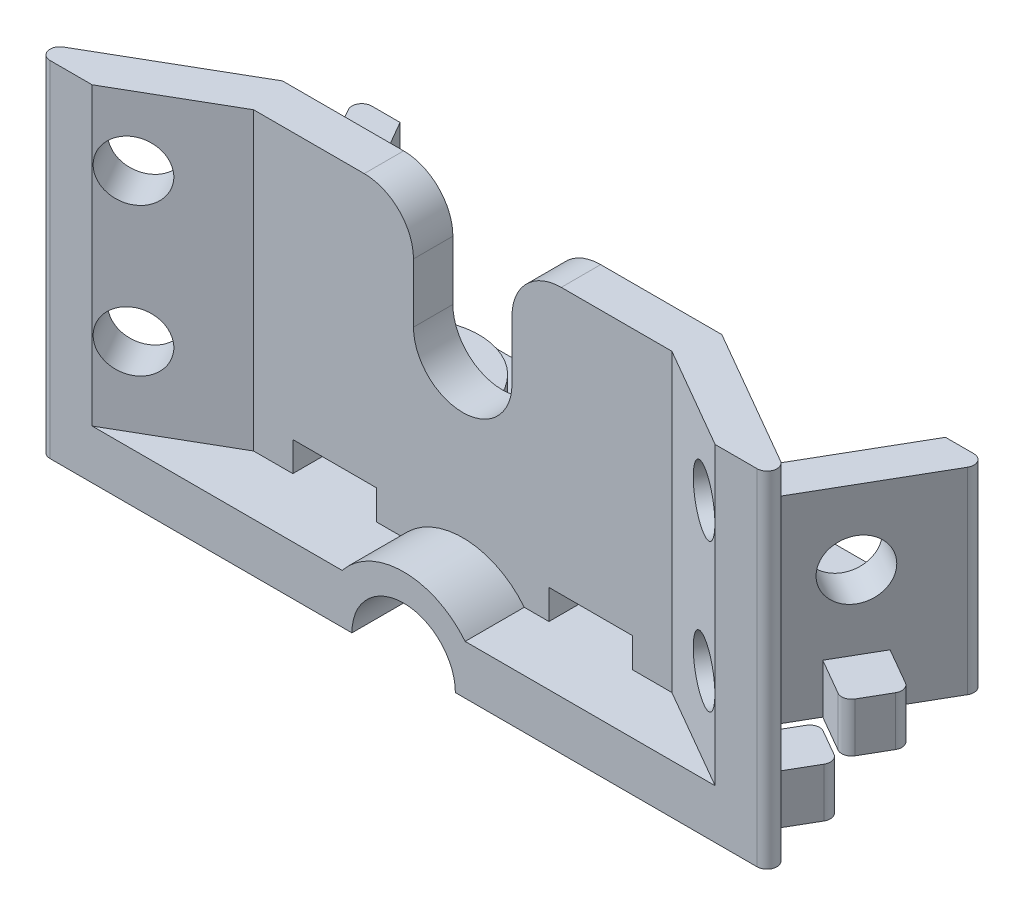
from build123d import *

# Parameters (mm, degrees)
BOSS_EXTRUDE1_DEPTH = 5
BOSS_EXTRUDE2_DEPTH = 30
BOSS_EXTRUDE3_DEPTH = 15
BOSS_EXTRUDE4_START = -27.320508
BOSS_EXTRUDE4_DEPTH = 27.320508
SKETCH6_R           = 5.25
CUT_EXTRUDE1_DEPTH  = 58.724937775
CUT_EXTRUDE2_DEPTH  = 56.139118094
SKETCH8_R           = 3
CUT_EXTRUDE3_DEPTH  = 61.901347721
SKETCH9_R           = 3
CUT_EXTRUDE4_DEPTH  = 70.587993831
SKETCH10_R          = 7
BOSS_EXTRUDE5_DEPTH = 7
SKETCH11_R          = 3
CUT_EXTRUDE5_DEPTH  = 52.343631003
CUT_EXTRUDE6_DEPTH  = 3
SKETCH14_R          = 1.5
CUT_EXTRUDE7_DEPTH  = 56.139118118


with BuildPart() as part:
    # Sketch2 → Boss-Extrude1 (new body)
    with BuildSketch(Plane(origin=(0, 0, 0), x_dir=(1, 0, 0), z_dir=(0, 1, 0))):
        with BuildLine():
            Line((-30.567949192, 27.320508076), (30.567949192, 27.320508076))
            ThreePointArc((30.567949192, 27.320508076), (31.433974596, 26.820508076), (31.433974596, 25.820508076))
            Line((31.433974596, 25.820508076), (28.55, 20.825317547))
            Line((28.55, 20.825317547), (32.230607966, 18.700317547))
            ThreePointArc((32.230607966, 18.700317547), (32.696533792, 18.093111189), (32.59663337, 17.334292144))
            Line((32.59663337, 17.334292144), (31.09663337, 14.736215932))
            ThreePointArc((31.09663337, 14.736215932), (30.489427011, 14.270290106), (29.730607966, 14.370190528))
            Line((29.730607966, 14.370190528), (26.05, 16.495190528))
            Line((26.05, 16.495190528), (22.3, 10))
            Line((22.3, 10), (28.795190528, 6.25))
            Line((28.795190528, 6.25), (30.920190528, 9.930607966))
            ThreePointArc((30.920190528, 9.930607966), (31.527396887, 10.396533792), (32.286215932, 10.29663337))
            Line((32.286215932, 10.29663337), (34.884292144, 8.79663337))
            ThreePointArc((34.884292144, 8.79663337), (35.35021797, 8.189427011), (35.250317547, 7.430607966))
            Line((35.250317547, 7.430607966), (33.125317547, 3.75))
            Line((33.125317547, 3.75), (36.388457268, 1.866025404))
            ThreePointArc((36.388457268, 1.866025404), (36.854383094, 0.741180955), (35.888457268, 0))
            Line((35.888457268, 0), (-35.888457268, 0))
            ThreePointArc((-35.888457268, 0), (-36.854383094, 0.741180955), (-36.388457268, 1.866025404))
            Line((-36.388457268, 1.866025404), (-33.125317547, 3.75))
            Line((-33.125317547, 3.75), (-35.250317547, 7.430607966))
            ThreePointArc((-35.250317547, 7.430607966), (-35.35021797, 8.189427011), (-34.884292144, 8.79663337))
            Line((-34.884292144, 8.79663337), (-32.286215932, 10.29663337))
            ThreePointArc((-32.286215932, 10.29663337), (-31.527396887, 10.396533792), (-30.920190528, 9.930607966))
            Line((-30.920190528, 9.930607966), (-28.795190528, 6.25))
            Line((-28.795190528, 6.25), (-22.3, 10))
            Line((-22.3, 10), (-26.05, 16.495190528))
            Line((-26.05, 16.495190528), (-29.730607966, 14.370190528))
            ThreePointArc((-29.730607966, 14.370190528), (-30.489427011, 14.270290106), (-31.09663337, 14.736215932))
            Line((-31.09663337, 14.736215932), (-32.59663337, 17.334292144))
            ThreePointArc((-32.59663337, 17.334292144), (-32.696533792, 18.093111189), (-32.230607966, 18.700317547))
            Line((-32.230607966, 18.700317547), (-28.55, 20.825317547))
            Line((-28.55, 20.825317547), (-31.433974596, 25.820508076))
            ThreePointArc((-31.433974596, 25.820508076), (-31.433974596, 26.820508076), (-30.567949192, 27.320508076))
        make_face()
    extrude(amount=BOSS_EXTRUDE1_DEPTH)

    # Sketch3 → Boss-Extrude2 (add)
    with BuildSketch(Plane(origin=(0, 5, 0), x_dir=(1, 0, 0), z_dir=(0, 1, 0))):
        with BuildLine():
            Line((-36.388457268, 1.866025404), (-22.3, 10))
            Line((-22.3, 10), (22.3, 10))
            Line((22.3, 10), (36.388457268, 1.866025404))
            ThreePointArc((36.388457268, 1.866025404), (36.854383094, 0.741180955), (35.888457268, 0))
            Line((35.888457268, 0), (31.620508076, 0))
            Line((31.620508076, 0), (21.22820323, 6))
            Line((21.22820323, 6), (-21.22820323, 6))
            Line((-21.22820323, 6), (-31.620508076, 0))
            Line((-31.620508076, 0), (-35.888457268, 0))
            ThreePointArc((-35.888457268, 0), (-36.854383094, 0.741180955), (-36.388457268, 1.866025404))
        make_face()
    extrude(amount=BOSS_EXTRUDE2_DEPTH)

    # Sketch4 → Boss-Extrude3 (add)
    with BuildSketch(Plane(origin=(0, 5, 0), x_dir=(1, 0, 0), z_dir=(0, 1, 0))):
        with BuildLine():
            Line((22.3, 10), (31.433974596, 25.820508076))
            ThreePointArc((31.433974596, 25.820508076), (31.433974596, 26.820508076), (30.567949192, 27.320508076))
            Line((30.567949192, 27.320508076), (27.681197846, 27.320508076))
            Line((27.681197846, 27.320508076), (17.681197846, 10))
            Line((17.681197846, 10), (22.3, 10))
        make_face()
        with BuildLine():
            Line((-27.681197846, 27.320508076), (-30.567949192, 27.320508076))
            ThreePointArc((-30.567949192, 27.320508076), (-31.433974596, 26.820508076), (-31.433974596, 25.820508076))
            Line((-31.433974596, 25.820508076), (-22.3, 10))
            Line((-22.3, 10), (-17.681197846, 10))
            Line((-17.681197846, 10), (-27.681197846, 27.320508076))
        make_face()
    extrude(amount=BOSS_EXTRUDE3_DEPTH)

    # Sketch5 → Boss-Extrude4 (add)
    with BuildSketch(Plane.XY.offset(BOSS_EXTRUDE4_START)):
        with BuildLine():
            Line((-8, 0), (8, 0))
            ThreePointArc((8, 0), (0, 8), (-8, 0))
        make_face()
    extrude(amount=BOSS_EXTRUDE4_DEPTH)

    # Sketch6 → Cut-Extrude1 (cut, through all)
    with BuildSketch(Plane.XY):
        Circle(SKETCH6_R)
    extrude(amount=-CUT_EXTRUDE1_DEPTH, mode=Mode.SUBTRACT)

    # Sketch7 → Cut-Extrude2 (cut, through all)
    with BuildSketch(Plane.XY.offset(-6)):
        with BuildLine():
            Line((-10, 35), (10, 35))
            ThreePointArc((10, 35), (6.464466094, 33.535533906), (5, 30))
            Line((5, 30), (5, 24))
            ThreePointArc((5, 24), (0, 19), (-5, 24))
            Line((-5, 24), (-5, 30))
            ThreePointArc((-5, 30), (-6.464466094, 33.535533906), (-10, 35))
        make_face()
    extrude(amount=-CUT_EXTRUDE2_DEPTH, mode=Mode.SUBTRACT)

    # Sketch8 → Cut-Extrude3 (cut, through all)
    with BuildSketch(Plane(origin=(-9.905127019, 0, -17.156183252), x_dir=(-0.8660254037844285, 0, 0.5000000000000177), z_dir=(-0.5000000000000177, 0, -0.8660254037844285))):
        with Locations((24.312366504, 28)):
            Circle(SKETCH8_R)
        with Locations((24.312366504, 13)):
            Circle(SKETCH8_R)
    cut_extrude3 = extrude(amount=-CUT_EXTRUDE3_DEPTH, mode=Mode.SUBTRACT)

    # Sketch9 → Cut-Extrude4 (cut, through all)
    with BuildSketch(Plane(origin=(-12.394872981, 0, 7.156183252), x_dir=(0.5000000000000591, 0, 0.8660254037844046), z_dir=(-0.8660254037844046, 0, 0.5000000000000591))):
        with Locations((-29.810254038, 12.5)):
            Circle(SKETCH9_R)
    cut_extrude4 = extrude(amount=-CUT_EXTRUDE4_DEPTH, mode=Mode.SUBTRACT)

    # Sketch10 → Boss-Extrude5 (add)
    with BuildSketch(Plane(origin=(0, 5, 0), x_dir=(1, 0, 0), z_dir=(0, 1, 0))):
        with Locations((-13, 13.660254038)):
            Circle(SKETCH10_R)
    boss_extrude5 = extrude(amount=BOSS_EXTRUDE5_DEPTH)

    # Sketch11 → Cut-Extrude5 (cut, through all)
    with BuildSketch(Plane(origin=(0, 12, 0), x_dir=(1, 0, 0), z_dir=(0, 1, 0))):
        with Locations(Location((-13, 13.660254038, 0), (0, 0, 270))):
            Circle(SKETCH11_R)
    cut_extrude5 = extrude(amount=-CUT_EXTRUDE5_DEPTH, mode=Mode.SUBTRACT)

    # Sketch13 → Cut-Extrude6 (cut)
    with BuildSketch(Plane(origin=(0, 5, 0), x_dir=(1, 0, 0), z_dir=(0, 1, 0))):
        Polygon((-17.25, 11.206515394), (-17.25, 6), (-8.75, 6), (-8.75, 11.206515394), (-8.75, 16.113992682), (-13, 18.567731326), (-17.25, 16.113992682), align=None)
    cut_extrude6 = extrude(amount=CUT_EXTRUDE6_DEPTH, mode=Mode.SUBTRACT)

    # Sketch14 → Cut-Extrude7 (cut, through all)
    with BuildSketch(Plane.XY.offset(-6)):
        with Locations(Location((-13, 6.5, 0), (0, 0, 270))):
            Circle(SKETCH14_R)
    cut_extrude7 = extrude(amount=-CUT_EXTRUDE7_DEPTH, mode=Mode.SUBTRACT)

    # Mirror1: Cut-Extrude3, Cut-Extrude4, Boss-Extrude5, Cut-Extrude5, Cut-Extrude6, Cut-Extrude7 across plane
    add(cut_extrude3.mirror(Plane(origin=(0, 0, 0), x_dir=(0, 0, 1), z_dir=(1, 0, 0))), mode=Mode.SUBTRACT)
    add(cut_extrude4.mirror(Plane(origin=(0, 0, 0), x_dir=(0, 0, 1), z_dir=(1, 0, 0))), mode=Mode.SUBTRACT)
    add(boss_extrude5.mirror(Plane(origin=(0, 0, 0), x_dir=(0, 0, 1), z_dir=(1, 0, 0))))
    add(cut_extrude5.mirror(Plane(origin=(0, 0, 0), x_dir=(0, 0, 1), z_dir=(1, 0, 0))), mode=Mode.SUBTRACT)
    add(cut_extrude6.mirror(Plane(origin=(0, 0, 0), x_dir=(0, 0, 1), z_dir=(1, 0, 0))), mode=Mode.SUBTRACT)
    add(cut_extrude7.mirror(Plane(origin=(0, 0, 0), x_dir=(0, 0, 1), z_dir=(1, 0, 0))), mode=Mode.SUBTRACT)


solid = part.part
